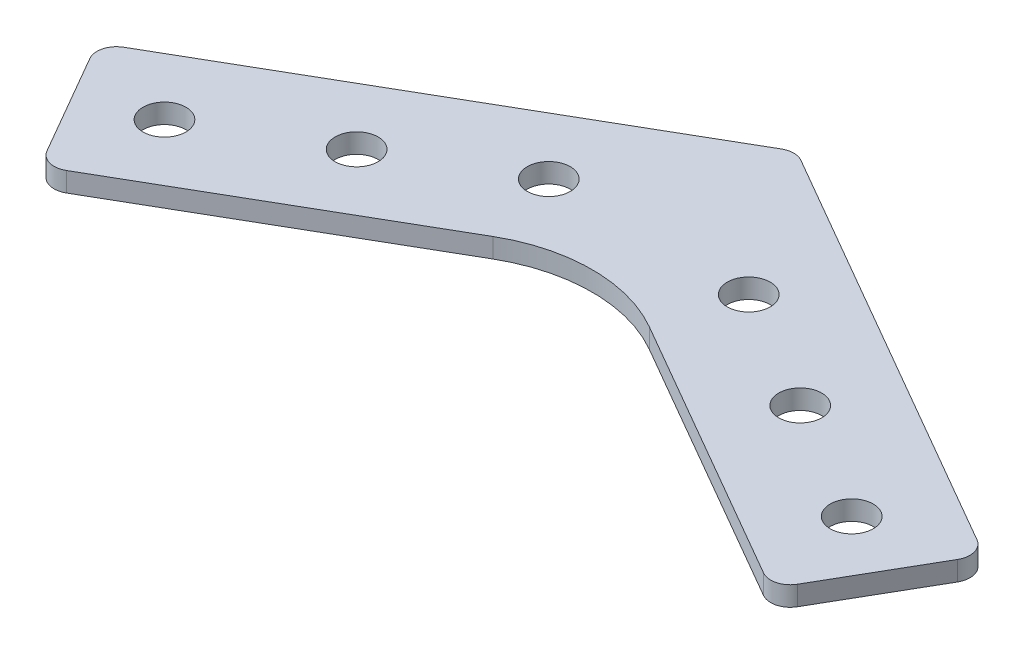
from build123d import *

# Parameters (mm, degrees)
BOSS_EXTRUDE1_DEPTH = 3.175
SKETCH2_R           = 3.4925
CUT_EXTRUDE2_DEPTH  = 3.175
LPATTERN5_COUNT     = 3
LPATTERN5_PITCH     = 22.86
SKETCH7_R           = 3.4925
CUT_EXTRUDE3_DEPTH  = 3.175
LPATTERN6_COUNT     = 3
LPATTERN6_PITCH     = 22.86
FILLET1_R           = 3.175
FILLET3_R           = 3.175
FILLET4_R           = 25.4


with BuildPart() as part:
    # Sketch1 → Boss-Extrude1 (new body)
    with BuildSketch(Plane(origin=(0, 0, 0), x_dir=(1, 0, 0), z_dir=(0, 1, 0))):
        Polygon((-25.4, 14.664696837), (0, 29.329393675), (25.4, 14.664696837), (72.092022192, -12.292954744), (59.392022192, -34.29), (0, 0), (-59.392022192, -34.29), (-72.092022192, -12.292954744), align=None)
    extrude(amount=BOSS_EXTRUDE1_DEPTH)

    # Sketch2 → Cut-Extrude2 (cut)
    with BuildSketch(Plane(origin=(0, 3.175, 0), x_dir=(1, 0, 0), z_dir=(0, 1, 0))):
        with Locations((-55.843351826, -17.576477372)):
            Circle(SKETCH2_R)
    cut_extrude2 = extrude(amount=-CUT_EXTRUDE2_DEPTH, mode=Mode.SUBTRACT)

    # LPattern5: Cut-Extrude2 ×3
    with Locations(*[Vector(0.8660254037844387, 0, -0.5000000000000001) * (i * LPATTERN5_PITCH) for i in range(1, LPATTERN5_COUNT)]):
        add(cut_extrude2, mode=Mode.SUBTRACT)

    # Sketch7 → Cut-Extrude3 (cut)
    with BuildSketch(Plane(origin=(0, 3.175, 0), x_dir=(1, 0, 0), z_dir=(0, 1, 0))):
        with Locations((55.843351826, -17.576477372)):
            Circle(SKETCH7_R)
    cut_extrude3 = extrude(amount=-CUT_EXTRUDE3_DEPTH, mode=Mode.SUBTRACT)

    # LPattern6: Cut-Extrude3 ×3
    with Locations(*[Vector(-0.8660254037844377, 0, -0.5000000000000018) * (i * LPATTERN6_PITCH) for i in range(1, LPATTERN6_COUNT)]):
        add(cut_extrude3, mode=Mode.SUBTRACT)

    # Fillet1
    fillet1_edges = [part.edges().sort_by_distance(p)[0] for p in [
        (-59.392022192, 1.5875, 34.29),
        (-72.092022192, 1.5875, 12.292954744),
        (72.092022192, 1.5875, 12.292954744),
        (59.392022192, 1.5875, 34.29),
    ]]
    fillet(fillet1_edges, radius=FILLET1_R)

    # Fillet3
    fillet3_edges = [part.edges().sort_by_distance(p)[0] for p in [
        (0, 1.5875, -29.329393675),
    ]]
    fillet(fillet3_edges, radius=FILLET3_R)

    # Fillet4
    fillet4_edges = [part.edges().sort_by_distance(p)[0] for p in [
        (0, 1.5875, 0),
    ]]
    fillet(fillet4_edges, radius=FILLET4_R)


solid = part.part
